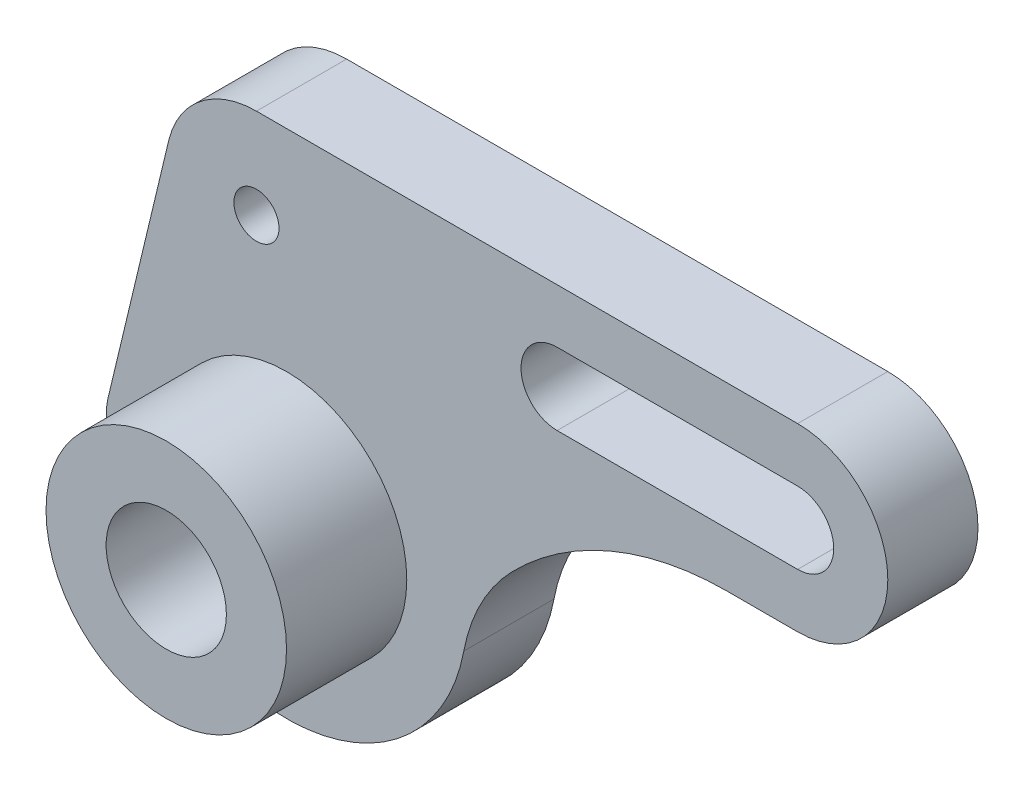
from build123d import *

# Parameters (mm, degrees)
SKETCH1_R           = 3.75
BOSS_EXTRUDE1_DEPTH = 15
SKETCH2_R           = 20
BOSS_EXTRUDE2_DEPTH = 20
SKETCH4_R           = 10
CUT_EXTRUDE1_DEPTH  = 35


with BuildPart() as part:
    # Sketch1 → Boss-Extrude1 (new body)
    with BuildSketch(Plane.XY):
        with BuildLine():
            Line((45, 55), (85, 55))
            ThreePointArc((85, 55), (100, 40), (85, 25))
            Line((85, 25), (73.301270189, 25))
            ThreePointArc((73.301270189, 25), (53.864269805, 21.067374747), (37.484806964, 9.888120643))
            ThreePointArc((37.484806964, 9.888120643), (32.346878, 2.774072366), (29.48734245, -5.522375871))
            ThreePointArc((29.48734245, -5.522375871), (-1.978417772, -29.934693303), (-29.957644649, -1.593589371))
            ThreePointArc((-29.957644649, -1.593589371), (-29.930461106, -0.154464501), (-29.696951333, 1.265849732))
            Line((-29.696951333, 1.265849732), (-19.587782351, 43.492363969))
            ThreePointArc((-19.587782351, 43.492363969), (-14.290170624, 51.776787753), (-5, 55))
            Line((-5, 55), (45, 55))
        make_face()
        with Locations((-5, 40)):
            Circle(SKETCH1_R, mode=Mode.SUBTRACT)
        with BuildLine():
            Line((45, 46), (85, 46))
            ThreePointArc((85, 46), (91, 40), (85, 34))
            Line((85, 34), (45, 34))
            ThreePointArc((45, 34), (39, 40), (45, 46))
        make_face(mode=Mode.SUBTRACT)
    extrude(amount=BOSS_EXTRUDE1_DEPTH)

    # Sketch2 → Boss-Extrude2 (add)
    with BuildSketch(Plane.XY.offset(15)):
        Circle(SKETCH2_R)
    extrude(amount=BOSS_EXTRUDE2_DEPTH)

    # Sketch4 → Cut-Extrude1 (cut)
    with BuildSketch(Plane.XY.offset(35)):
        Circle(SKETCH4_R)
    extrude(amount=-CUT_EXTRUDE1_DEPTH, mode=Mode.SUBTRACT)


solid = part.part
